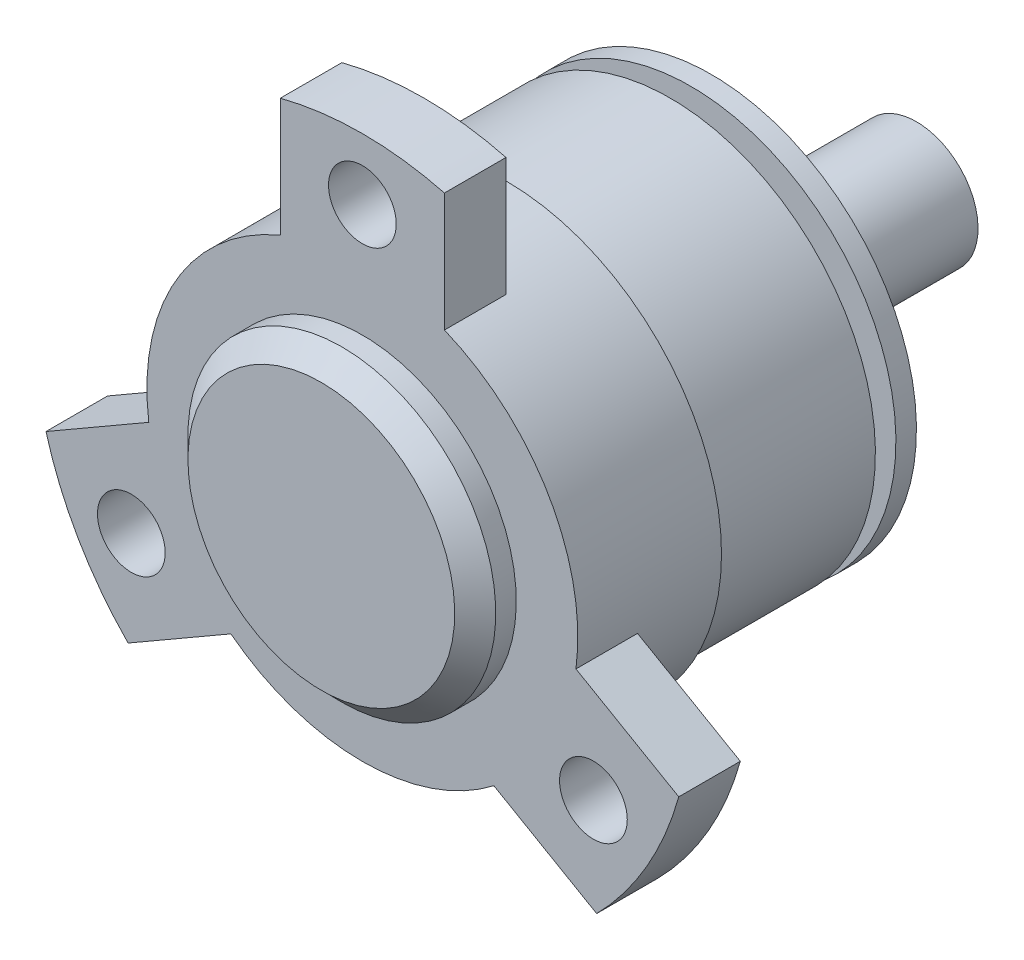
from build123d import *

# Parameters (mm, degrees)
HOLE_WIZARD_M4_1_D  = 3.3
SKETCH_4_OUTSIDE_W  = 44.75
SKETCH_4_OUTSIDE_H  = 44.75
CUT_EXTRUDE_4_DEPTH = 3
CHAMFER_1_SIZE      = 1


with BuildPart() as part:
    # 草图1 → 旋转1 (revolve)
    with BuildSketch(Plane(origin=(0, 0, 0), x_dir=(0, 0, -1), z_dir=(1, 0, 0)), mode=Mode.PRIVATE) as revolve_1_sk:
        Polygon((0, 0), (29, 0), (29, 3), (19, 3), (19, 10), (18, 10), (18, 8.5), (17, 8.5), (17, 10), (9, 10), (9, 10.5), (5, 10.5), (5, 16), (2, 16), (2, 7.5), (0, 7.5), align=None)
    revolve(revolve_1_sk.sketch.rotate(Axis((0, 0, 0), (0, 0, -1)), 180), axis=Axis((0, 0, 0), (0, 0, -1)))

    # M4 螺纹孔1 (through all)
    with Locations(Plane.XY.offset(-2)):
        with Locations((0, 13), (11.258330249, -6.5), (-11.258330249, -6.5)):
            Hole(HOLE_WIZARD_M4_1_D / 2)

    # 草图4 outside → 切除-拉伸4 (cut)
    with BuildSketch(Plane.XY.offset(-2)):
        Rectangle(SKETCH_4_OUTSIDE_W, SKETCH_4_OUTSIDE_H)
        with BuildLine():
            Line((4, 15.491933385), (4, 9.708243919))
            ThreePointArc((4, 9.708243919), (9.09326674, 5.25), (10.40758586, -1.390020345))
            Line((10.40758586, -1.390020345), (15.416407865, -4.281865077))
            ThreePointArc((15.416407865, -4.281865077), (13.856406461, -8), (11.416407865, -11.210068308))
            Line((11.416407865, -11.210068308), (6.40758586, -8.318223575))
            ThreePointArc((6.40758586, -8.318223575), (0, -10.5), (-6.40758586, -8.318223575))
            Line((-6.40758586, -8.318223575), (-11.416407865, -11.210068308))
            ThreePointArc((-11.416407865, -11.210068308), (-13.856406461, -8), (-15.416407865, -4.281865077))
            Line((-15.416407865, -4.281865077), (-10.40758586, -1.390020345))
            ThreePointArc((-10.40758586, -1.390020345), (-9.09326674, 5.25), (-4, 9.708243919))
            Line((-4, 9.708243919), (-4, 15.491933385))
            ThreePointArc((-4, 15.491933385), (0, 16), (4, 15.491933385))
        make_face(mode=Mode.SUBTRACT)
    extrude(amount=-CUT_EXTRUDE_4_DEPTH, mode=Mode.SUBTRACT)

    # 倒角1
    chamfer_1_edges = [part.edges().sort_by_distance(p)[0] for p in [
        (0, 7.5, 0),
    ]]
    chamfer(chamfer_1_edges, length=CHAMFER_1_SIZE)


solid = part.part
